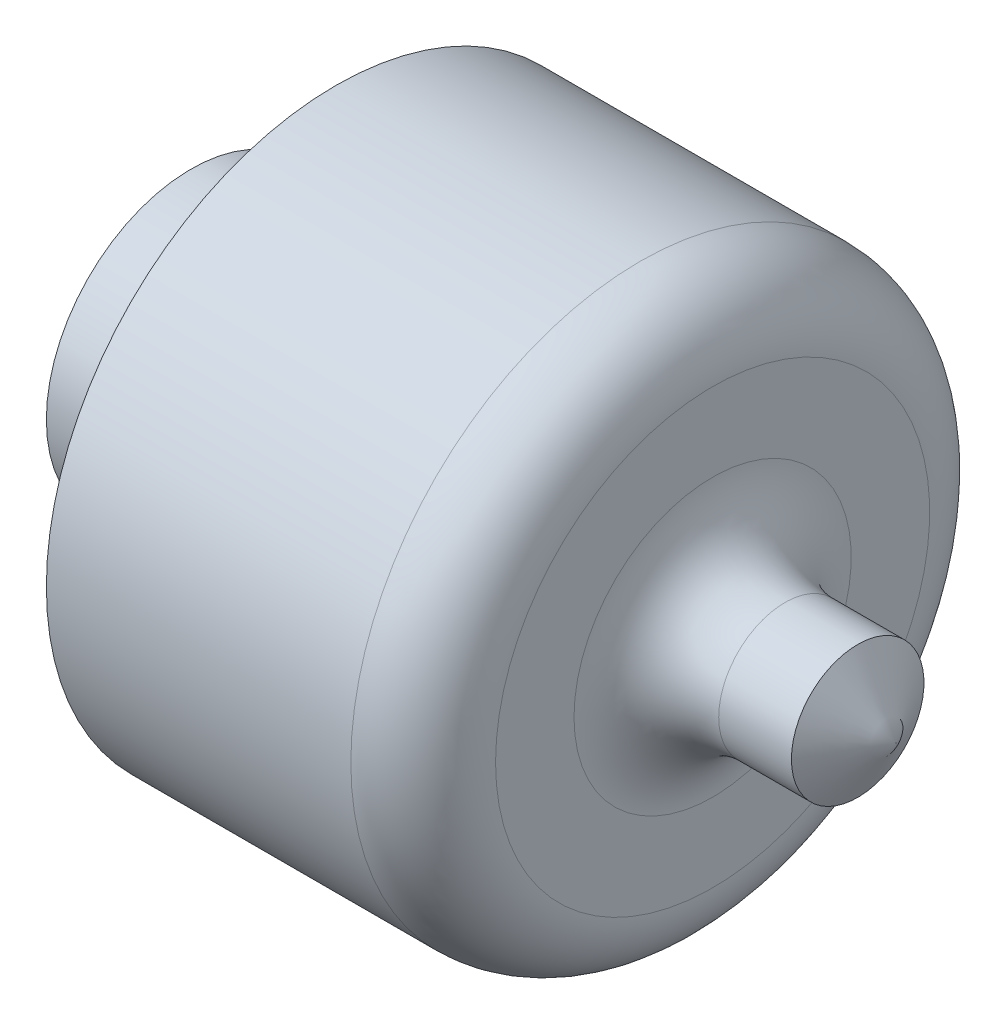
from build123d import *


with BuildPart() as part:
    # Esquisse1 → Révolution1 (revolve)
    with BuildSketch(Plane.XY, mode=Mode.PRIVATE) as r_volution1_sk:
        with BuildLine():
            Line((0, 0), (48.706777749, 0))
            Line((48.706777749, 0), (46.062888871, 4.579349866))
            Line((46.062888871, 4.579349866), (41.039040874, 4.579349866))
            ThreePointArc((41.039040874, 4.579349866), (37.503506968, 6.04381596), (36.039040874, 9.579349866))
            Line((36.039040874, 9.579349866), (36.039040874, 15))
            ThreePointArc((36.039040874, 15), (34.57457478, 18.535533906), (31.039040874, 20))
            Line((31.039040874, 20), (10, 20))
            Line((10, 20), (10, 10))
            Line((10, 10), (0, 10))
            Line((0, 10), (0, 0))
        make_face()
    revolve(r_volution1_sk.sketch.rotate(Axis((0, 0, 0), (1, 0, 0)), 90), axis=Axis((0, 0, 0), (1, 0, 0)))


solid = part.part
